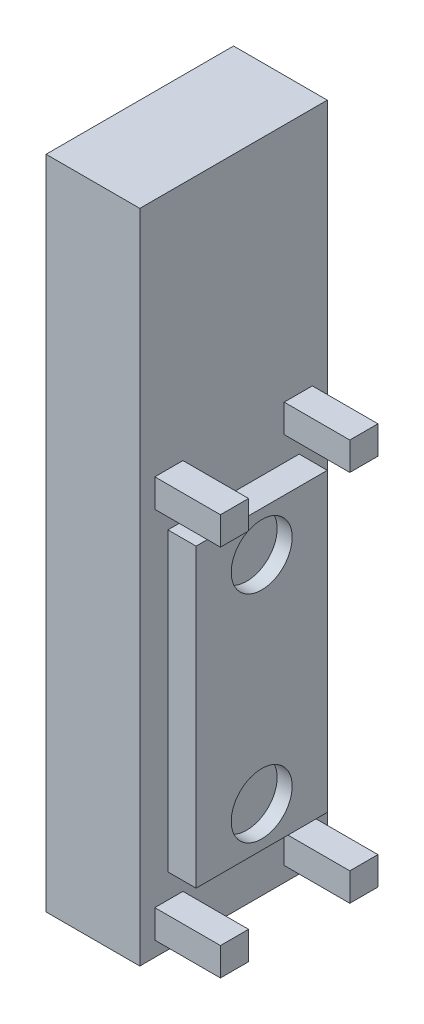
from build123d import *

# Parameters (mm, degrees)
SKETCH1_W           = 20
SKETCH1_H           = 70
BOSS_EXTRUDE1_DEPTH = 10
SKETCH2_W           = 3
SKETCH2_H           = 3
BOSS_EXTRUDE2_DEPTH = 7
SKETCH3_W           = 14
SKETCH3_H           = 31.6
BOSS_EXTRUDE3_DEPTH = 3
SKETCH4_R           = 3.25
CUT_EXTRUDE1_DEPTH  = 1.6


with BuildPart() as part:
    # Sketch1 → Boss-Extrude1 (new body)
    with BuildSketch(Plane(origin=(0, 0, 0), x_dir=(0, 0, -1), z_dir=(1, 0, 0))):
        Rectangle(SKETCH1_W, SKETCH1_H)
    extrude(amount=BOSS_EXTRUDE1_DEPTH)

    # Sketch2 → Boss-Extrude2 (add)
    with BuildSketch(Plane(origin=(10, 0, 0), x_dir=(0, 0, -1), z_dir=(1, 0, 0))):
        with Locations((-6.9, 7.9)):
            Rectangle(SKETCH2_W, SKETCH2_H)
        with Locations((6.9, 7.9)):
            Rectangle(SKETCH2_W, SKETCH2_H)
        with Locations((6.9, -31.9)):
            Rectangle(SKETCH2_W, SKETCH2_H)
        with Locations((-6.9, -31.9)):
            Rectangle(SKETCH2_W, SKETCH2_H)
    extrude(amount=BOSS_EXTRUDE2_DEPTH)

    # Sketch3 → Boss-Extrude3 (add)
    with BuildSketch(Plane(origin=(10, 0, 0), x_dir=(0, 0, -1), z_dir=(1, 0, 0))):
        with Locations((0, -12)):
            Rectangle(SKETCH3_W, SKETCH3_H)
    extrude(amount=BOSS_EXTRUDE3_DEPTH)

    # Sketch4 → Cut-Extrude1 (cut)
    with BuildSketch(Plane(origin=(13, 0, 0), x_dir=(0, 0, -1), z_dir=(1, 0, 0))):
        with Locations((0, -23.5)):
            Circle(SKETCH4_R)
        with Locations((0, -0.5)):
            Circle(SKETCH4_R)
    extrude(amount=-CUT_EXTRUDE1_DEPTH, mode=Mode.SUBTRACT)


solid = part.part
